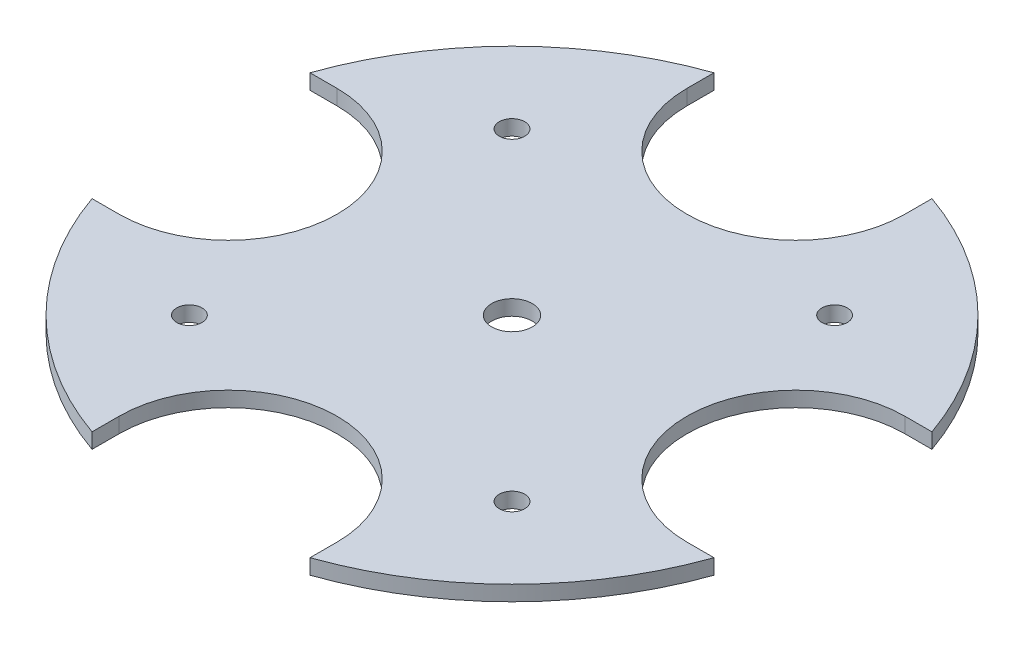
from build123d import *

# Parameters (mm, degrees)
SKETCH1_R           = 4
SKETCH1_R_2         = 2.5
BOSS_EXTRUDE1_DEPTH = 3


with BuildPart() as part:
    # Sketch1 → Boss-Extrude1 (new body)
    with BuildSketch(Plane(origin=(0, 0, 0), x_dir=(1, 0, 0), z_dir=(0, 1, 0))):
        with BuildLine():
            Line((-56, 21.5), (-61.341258546, 21.5))
            ThreePointArc((-61.341258546, 21.5), (-45.961940777, 45.961940777), (-21.5, 61.341258546))
            Line((-21.5, 61.341258546), (-21.5, 56))
            ThreePointArc((-21.5, 56), (0, 34.5), (21.5, 56))
            Line((21.5, 56), (21.5, 61.341258546))
            ThreePointArc((21.5, 61.341258546), (45.961940777, 45.961940777), (61.341258546, 21.5))
            Line((61.341258546, 21.5), (56, 21.5))
            ThreePointArc((56, 21.5), (34.5, 0), (56, -21.5))
            Line((56, -21.5), (61.341258546, -21.5))
            ThreePointArc((61.341258546, -21.5), (45.961940777, -45.961940777), (21.5, -61.341258546))
            Line((21.5, -61.341258546), (21.5, -56))
            ThreePointArc((21.5, -56), (0, -34.5), (-21.5, -56))
            Line((-21.5, -56), (-21.5, -61.341258546))
            ThreePointArc((-21.5, -61.341258546), (-45.961940777, -45.961940777), (-61.341258546, -21.5))
            Line((-61.341258546, -21.5), (-56, -21.5))
            ThreePointArc((-56, -21.5), (-34.5, 0), (-56, 21.5))
        make_face()
        with Locations(Location((0, 0, 0), (0, 0, 270))):
            Circle(SKETCH1_R, mode=Mode.SUBTRACT)
        with Locations(Location((-31.819805153, 31.819805153, 0), (0, 0, 270))):
            Circle(SKETCH1_R_2, mode=Mode.SUBTRACT)
        with Locations(Location((31.819805153, 31.819805153, 0), (0, 0, 270))):
            Circle(SKETCH1_R_2, mode=Mode.SUBTRACT)
        with Locations(Location((31.819805153, -31.819805153, 0), (0, 0, 270))):
            Circle(SKETCH1_R_2, mode=Mode.SUBTRACT)
        with Locations(Location((-31.819805153, -31.819805153, 0), (0, 0, 270))):
            Circle(SKETCH1_R_2, mode=Mode.SUBTRACT)
    extrude(amount=BOSS_EXTRUDE1_DEPTH)


solid = part.part
